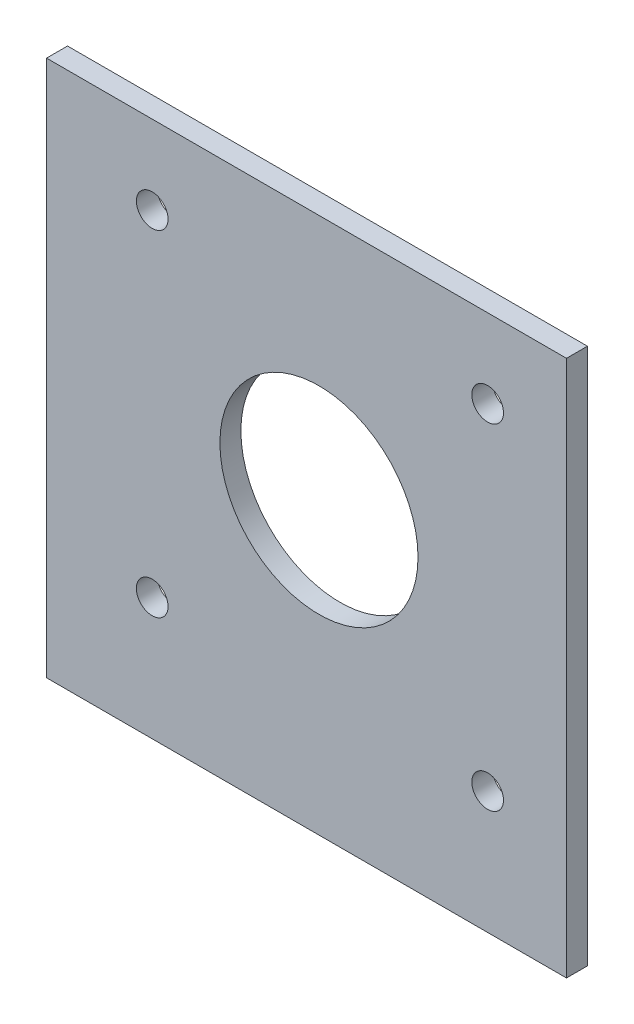
from build123d import *

# Parameters (mm, degrees)
SKETCH2_W            = 68.58
SKETCH2_H            = 76.2
BOSS_EXTRUDE1_DEPTH  = 1.5875
M4_CLEARANCE_HOLE1_D = 4.8
SKETCH5_R            = 15
CUT_EXTRUDE1_DEPTH   = 52.356545104
BOSS_EXTRUDE2_DEPTH  = 3.175


with BuildPart() as part:
    # Sketch2 → Boss-Extrude1 (new, symmetric)
    with BuildSketch(Plane.XY):
        Rectangle(SKETCH2_W, SKETCH2_H)
    extrude(amount=BOSS_EXTRUDE1_DEPTH, both=True)

    # M4 Clearance Hole1 (through all)
    with Locations(Plane.XY.offset(1.5875)):
        with Locations((-23.368, -19.558), (-23.368, 31.242), (27.432, 31.242), (27.432, -19.558)):
            Hole(M4_CLEARANCE_HOLE1_D / 2)

    # Sketch5 → Cut-Extrude1 (cut, through all)
    with BuildSketch(Plane.XY.offset(1.5875)):
        with Locations((1.884, 5.842)):
            Circle(SKETCH5_R)
    extrude(amount=-CUT_EXTRUDE1_DEPTH, mode=Mode.SUBTRACT)

    # Sketch6 → Boss-Extrude2 (add, through all)
    with BuildSketch(Plane(origin=(0, 0, -1.5875), x_dir=(-1, 0, 0), z_dir=(0, 0, -1))):
        Polygon((-39.37, 43.18), (-39.37, -38.1), (-34.29, -38.1), (-34.29, 38.1), (34.29, 38.1), (34.29, -38.1), (39.37, -38.1), (39.37, 43.18), align=None)
    extrude(amount=-BOSS_EXTRUDE2_DEPTH)


solid = part.part
